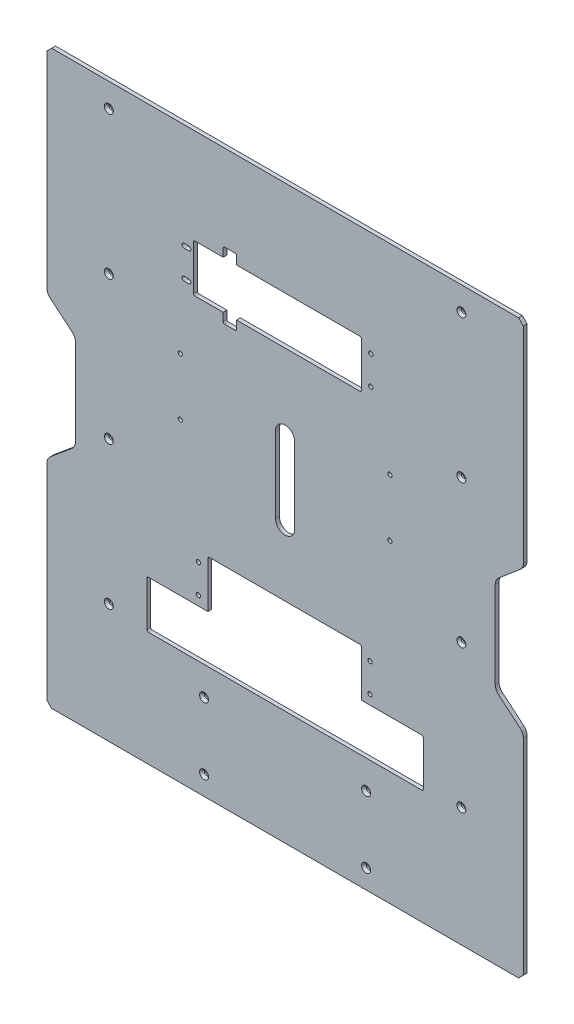
from build123d import *

# Parameters (mm, degrees)
SCHIZZO1_W                             = 500
SCHIZZO1_H                             = 600
ESTRUSIONE_ESTRUSIONE1_DEPTH           = 4
SCHIZZO2_W                             = 30
SCHIZZO2_H                             = 100
TAGLIO_ESTRUSIONE1_DEPTH               = 391.532969159
SCHIZZO3_W                             = 29.486887837
SCHIZZO3_H                             = 100
TAGLIO_ESTRUSIONE2_DEPTH               = 391.532969159
TAGLIO_ESTRUSIONE3_DEPTH               = 391.532969159
TAGLIO_ESTRUSIONE4_DEPTH               = 391.532969159
TAGLIO_ESTRUSIONE5_DEPTH               = 391.532969159
TAGLIO_ESTRUSIONE6_DEPTH               = 391.532969159
TAGLIO_ESTRUSIONE7_DEPTH               = 391.532969159
SFORMO1_ANGLE                          = 40.292427289
SFORMO2_ANGLE                          = 39.805571092
FORO_4_5_4_5_1_D                       = 4.5
FORO_SVASATO_PER_VITE_M4_1_AT_2_COUNT  = 2
FORO_SVASATO_PER_VITE_M4_1_AT_2_PITCH  = 150
FORO_SVASATO_PER_VITE_M4_1_AT_3_COUNT  = 2
FORO_SVASATO_PER_VITE_M4_1_AT_3_PITCH  = 300
FORO_SVASATO_PER_VITE_M4_1_AT_4_COUNT  = 2
FORO_SVASATO_PER_VITE_M4_1_AT_4_PITCH  = 450
FORO_SVASATO_PER_VITE_M4_1_AT_5_COUNT  = 2
FORO_SVASATO_PER_VITE_M4_1_AT_5_PITCH  = 370
FORO_SVASATO_PER_VITE_M4_1_AT_6_COUNT  = 2
FORO_SVASATO_PER_VITE_M4_1_AT_6_PITCH  = 399.249295554
FORO_SVASATO_PER_VITE_M4_1_AT_7_COUNT  = 2
FORO_SVASATO_PER_VITE_M4_1_AT_7_PITCH  = 476.340214553
FORO_SVASATO_PER_VITE_M4_1_AT_8_COUNT  = 2
FORO_SVASATO_PER_VITE_M4_1_AT_8_PITCH  = 582.580466545
FORO_SVASATO_PER_VITE_M4_1_AT_9_COUNT  = 2
FORO_SVASATO_PER_VITE_M4_1_AT_9_PITCH  = 105.948100502
FORO_SVASATO_PER_VITE_M4_1_AT_10_COUNT = 2
FORO_SVASATO_PER_VITE_M4_1_AT_10_PITCH = 272.259067801
FORO_SVASATO_PER_VITE_M4_1_AT_11_COUNT = 2
FORO_SVASATO_PER_VITE_M4_1_AT_11_PITCH = 289.698118737
FORO_SVASATO_PER_VITE_M4_1_AT_12_COUNT = 2
FORO_SVASATO_PER_VITE_M4_1_AT_12_PITCH = 145
SMUSSO1_SIZE                           = 5
RACCORDO1_R                            = 1.5
RACCORDO2_R                            = 10


with BuildPart() as part:
    # Schizzo1 → Estrusione-Estrusione1 (new body)
    with BuildSketch(Plane.XY.offset(4)):
        Rectangle(SCHIZZO1_W, SCHIZZO1_H)
    extrude(amount=-ESTRUSIONE_ESTRUSIONE1_DEPTH)

    # Schizzo2 → Taglio-Estrusione1 (cut, through all)
    with BuildSketch(Plane(origin=(0, 0, 0), x_dir=(-1, 0, 0), z_dir=(0, 0, -1))):
        with Locations((235, 0)):
            Rectangle(SCHIZZO2_W, SCHIZZO2_H)
    extrude(amount=-TAGLIO_ESTRUSIONE1_DEPTH, mode=Mode.SUBTRACT)

    # Schizzo3 → Taglio-Estrusione2 (cut, through all)
    with BuildSketch(Plane(origin=(0, 0, 0), x_dir=(-1, 0, 0), z_dir=(0, 0, -1))):
        with Locations((-235.256556082, 0)):
            Rectangle(SCHIZZO3_W, SCHIZZO3_H)
    extrude(amount=-TAGLIO_ESTRUSIONE2_DEPTH, mode=Mode.SUBTRACT)

    # Schizzo4 → Taglio-Estrusione3 (cut, through all)
    with BuildSketch(Plane.XY.offset(4)):
        Polygon((-145, -180), (145, -180), (145, -130), (80, -130), (80, -80), (-81, -80), (-81, -130), (-145, -130), align=None)
    extrude(amount=-TAGLIO_ESTRUSIONE3_DEPTH, mode=Mode.SUBTRACT)

    # Schizzo5 → Taglio-Estrusione4 (cut, through all)
    with BuildSketch(Plane.XY.offset(4)):
        with BuildLine():
            Line((10, -10), (10, 70))
            ThreePointArc((10, 70), (0, 80), (-10, 70))
            Line((-10, 70), (-10, -10))
            ThreePointArc((-10, -10), (0, -20), (10, -10))
        make_face()
    extrude(amount=-TAGLIO_ESTRUSIONE4_DEPTH, mode=Mode.SUBTRACT)

    # Schizzo6 → Taglio-Estrusione5 (cut, through all)
    with BuildSketch(Plane.XY.offset(4)):
        with BuildLine():
            Line((-101, 162.25), (-106, 162.25))
            ThreePointArc((-106, 162.25), (-108.25, 160), (-106, 157.75))
            Line((-106, 157.75), (-101, 157.75))
            ThreePointArc((-101, 157.75), (-98.75, 160), (-101, 162.25))
        make_face()
    extrude(amount=-TAGLIO_ESTRUSIONE5_DEPTH, mode=Mode.SUBTRACT)

    # Schizzo7 → Taglio-Estrusione6 (cut, through all)
    with BuildSketch(Plane.XY.offset(4)):
        with BuildLine():
            Line((-101, 192.25), (-106, 192.25))
            ThreePointArc((-106, 192.25), (-108.25, 190), (-106, 187.75))
            Line((-106, 187.75), (-101, 187.75))
            ThreePointArc((-101, 187.75), (-98.75, 190), (-101, 192.25))
        make_face()
    extrude(amount=-TAGLIO_ESTRUSIONE6_DEPTH, mode=Mode.SUBTRACT)

    # Schizzo8 → Taglio-Estrusione7 (cut, through all)
    with BuildSketch(Plane(origin=(0, 0, 0), x_dir=(-1, 0, 0), z_dir=(0, 0, -1))):
        Polygon((65, 200), (65, 210), (51, 210), (51, 200), (-80, 200), (-80, 150), (51, 150), (51, 140), (65, 140), (65, 150), (96, 150), (96, 200), align=None)
    extrude(amount=-TAGLIO_ESTRUSIONE7_DEPTH, mode=Mode.SUBTRACT)

    # Sformo1
    sformo1_faces = [part.faces().sort_by_distance(p)[0] for p in [
        (235.256556082, 50, 2),
        (235.256556082, -50, 2),
    ]]
    draft(sformo1_faces, Plane(origin=(220.513112163, -50, 4), x_dir=(0, 0, 1), z_dir=(1, 0, 0)), SFORMO1_ANGLE)

    # Sformo2
    sformo2_faces = [part.faces().sort_by_distance(p)[0] for p in [
        (-235, -50, 2),
        (-235, 50, 2),
    ]]
    draft(sformo2_faces, Plane(origin=(-220, 50, 4), x_dir=(0, -1, 0), z_dir=(-1, 0, 0)), SFORMO2_ANGLE)

    # Foro Ø4.5 (4.5)-1 (through all)
    with Locations(Plane.XY.offset(4)):
        with Locations((110, 90), (-110, 90), (110, 30), (-110, 30), (-91, -120), (-91, -90), (89, -120), (89, -90), (90, 190), (90, 160)):
            Hole(FORO_4_5_4_5_1_D / 2)

    # Schizzo11 → Foro svasato per Vite M4-1 (revolve, cut)
    with BuildSketch(Plane(origin=(-185, -175, 4), x_dir=(0, -1, 0), z_dir=(1, 0, 0))):
        Polygon((0, 0), (0, 4), (2.25, 4), (2.25, 2.45), (4.7, 0), align=None)
    foro_svasato_per_vite_m4_1 = revolve(axis=Axis((-185, -175, 10.35), (0, 0, -1)), mode=Mode.SUBTRACT)

    # Foro svasato per Vite M4-1 at 2: Foro svasato per Vite M4-1 ×2
    with Locations(*[(0, i * FORO_SVASATO_PER_VITE_M4_1_AT_2_PITCH, 0) for i in range(1, FORO_SVASATO_PER_VITE_M4_1_AT_2_COUNT)]):
        add(foro_svasato_per_vite_m4_1, mode=Mode.SUBTRACT)

    # Foro svasato per Vite M4-1 at 3: Foro svasato per Vite M4-1 ×2
    with Locations(*[(0, i * FORO_SVASATO_PER_VITE_M4_1_AT_3_PITCH, 0) for i in range(1, FORO_SVASATO_PER_VITE_M4_1_AT_3_COUNT)]):
        add(foro_svasato_per_vite_m4_1, mode=Mode.SUBTRACT)

    # Foro svasato per Vite M4-1 at 4: Foro svasato per Vite M4-1 ×2
    with Locations(*[(0, i * FORO_SVASATO_PER_VITE_M4_1_AT_4_PITCH, 0) for i in range(1, FORO_SVASATO_PER_VITE_M4_1_AT_4_COUNT)]):
        add(foro_svasato_per_vite_m4_1, mode=Mode.SUBTRACT)

    # Foro svasato per Vite M4-1 at 5: Foro svasato per Vite M4-1 ×2
    with Locations(*[(i * FORO_SVASATO_PER_VITE_M4_1_AT_5_PITCH, 0, 0) for i in range(1, FORO_SVASATO_PER_VITE_M4_1_AT_5_COUNT)]):
        add(foro_svasato_per_vite_m4_1, mode=Mode.SUBTRACT)

    # Foro svasato per Vite M4-1 at 6: Foro svasato per Vite M4-1 ×2
    with Locations(*[Vector(0.9267392682234048, 0.37570510873921886, 0) * (i * FORO_SVASATO_PER_VITE_M4_1_AT_6_PITCH) for i in range(1, FORO_SVASATO_PER_VITE_M4_1_AT_6_COUNT)]):
        add(foro_svasato_per_vite_m4_1, mode=Mode.SUBTRACT)

    # Foro svasato per Vite M4-1 at 7: Foro svasato per Vite M4-1 ×2
    with Locations(*[Vector(0.7767557487195029, 0.6298019584212203, 0) * (i * FORO_SVASATO_PER_VITE_M4_1_AT_7_PITCH) for i in range(1, FORO_SVASATO_PER_VITE_M4_1_AT_7_COUNT)]):
        add(foro_svasato_per_vite_m4_1, mode=Mode.SUBTRACT)

    # Foro svasato per Vite M4-1 at 8: Foro svasato per Vite M4-1 ×2
    with Locations(*[Vector(0.6351053995925638, 0.7724254859909594, 0) * (i * FORO_SVASATO_PER_VITE_M4_1_AT_8_PITCH) for i in range(1, FORO_SVASATO_PER_VITE_M4_1_AT_8_COUNT)]):
        add(foro_svasato_per_vite_m4_1, mode=Mode.SUBTRACT)

    # Foro svasato per Vite M4-1 at 9: Foro svasato per Vite M4-1 ×2
    with Locations(*[Vector(0.9438583563660176, -0.33035042472810594, 0) * (i * FORO_SVASATO_PER_VITE_M4_1_AT_9_PITCH) for i in range(1, FORO_SVASATO_PER_VITE_M4_1_AT_9_COUNT)]):
        add(foro_svasato_per_vite_m4_1, mode=Mode.SUBTRACT)

    # Foro svasato per Vite M4-1 at 10: Foro svasato per Vite M4-1 ×2
    with Locations(*[Vector(0.9917025066621883, -0.12855402864139467, 0) * (i * FORO_SVASATO_PER_VITE_M4_1_AT_10_PITCH) for i in range(1, FORO_SVASATO_PER_VITE_M4_1_AT_10_COUNT)]):
        add(foro_svasato_per_vite_m4_1, mode=Mode.SUBTRACT)

    # Foro svasato per Vite M4-1 at 11: Foro svasato per Vite M4-1 ×2
    with Locations(*[Vector(0.9320046715412964, -0.36244626115494755, 0) * (i * FORO_SVASATO_PER_VITE_M4_1_AT_11_PITCH) for i in range(1, FORO_SVASATO_PER_VITE_M4_1_AT_11_COUNT)]):
        add(foro_svasato_per_vite_m4_1, mode=Mode.SUBTRACT)

    # Foro svasato per Vite M4-1 at 12: Foro svasato per Vite M4-1 ×2
    with Locations(*[Vector(0.6896551724137958, -0.7241379310344802, 0) * (i * FORO_SVASATO_PER_VITE_M4_1_AT_12_PITCH) for i in range(1, FORO_SVASATO_PER_VITE_M4_1_AT_12_COUNT)]):
        add(foro_svasato_per_vite_m4_1, mode=Mode.SUBTRACT)

    # Smusso1
    smusso1_edges = [part.edges().sort_by_distance(p)[0] for p in [
        (250, -300, 2),
        (-250, -300, 2),
        (-250, 300, 2),
        (250, 300, 2),
    ]]
    chamfer(smusso1_edges, length=SMUSSO1_SIZE)

    # Raccordo1
    raccordo1_edges = [part.edges().sort_by_distance(p)[0] for p in [
        (-96, 200, 2),
        (-96, 150, 2),
        (-65, 140, 2),
        (-51, 140, 2),
        (80, 150, 2),
        (80, 200, 2),
        (-51, 210, 2),
        (-65, 210, 2),
        (-145, -180, 2),
        (-145, -130, 2),
        (-81, -80, 2),
        (80, -80, 2),
        (145, -130, 2),
        (145, -180, 2),
    ]]
    fillet(raccordo1_edges, radius=RACCORDO1_R)

    # Raccordo2
    raccordo2_edges = [part.edges().sort_by_distance(p)[0] for p in [
        (-250, -75, 2),
        (-220, -50, 2),
        (-220, 50, 2),
        (-250, 75, 2),
        (250, 75, 2),
        (220.513112163, 50, 2),
        (220.513112163, -50, 2),
        (250, -75, 2),
    ]]
    fillet(raccordo2_edges, radius=RACCORDO2_R)


solid = part.part
